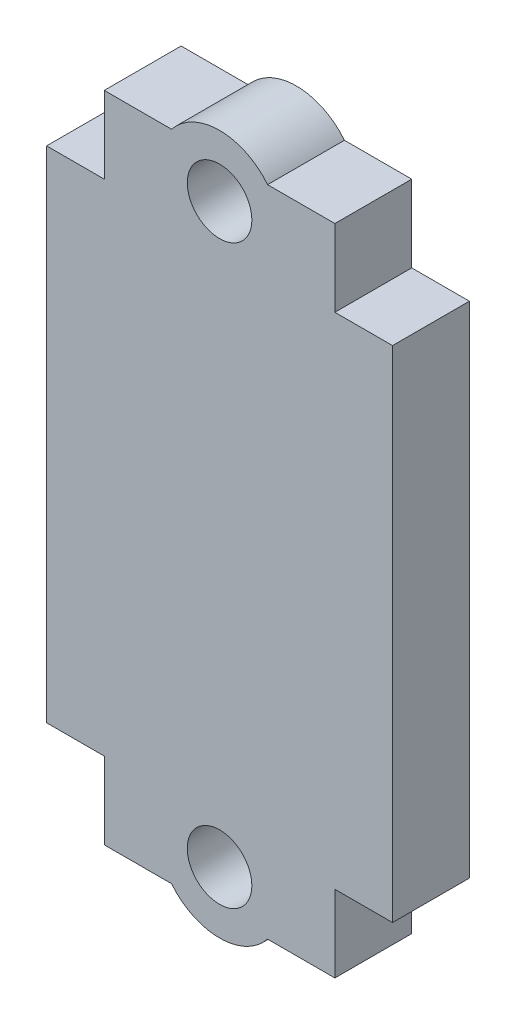
from build123d import *

# Parameters (mm, degrees)
SKETCH1_R           = 2.1
SKETCH1_W           = 22.5
SKETCH1_H           = 32.5
BOSS_EXTRUDE1_DEPTH = 5


with BuildPart() as part:
    # Sketch1 → Boss-Extrude1 (new body)
    # profile 1 of 5: a face of its own
    with BuildSketch(Plane.XY):
        Polygon((-18.75, 32.5), (-3.75, 32.5), (-3.75, 37.5), (-8.127501001, 37.5), (-14.372498999, 37.5), (-18.75, 37.5), align=None)
        with Locations((-11.25, 35)):
            Circle(SKETCH1_R, mode=Mode.SUBTRACT)
    # profile 2 of 5: a face of its own
    with BuildSketch(Plane.XY):
        with Locations((-11.25, 16.25)):
            Rectangle(SKETCH1_W, SKETCH1_H)
    # profile 3 of 5: a face of its own
    with BuildSketch(Plane.XY):
        Polygon((-3.75, -5), (-3.75, 0), (-18.75, 0), (-18.75, -5), (-14.372498999, -5), (-8.127501001, -5), align=None)
        with Locations((-11.25, -2.5)):
            Circle(SKETCH1_R, mode=Mode.SUBTRACT)
    # profile 4 of 5: a face of its own
    with BuildSketch(Plane.XY):
        with BuildLine():
            ThreePointArc((-14.372498999, -5), (-11.25, -6.5), (-8.127501001, -5))
            Line((-8.127501001, -5), (-14.372498999, -5))
        make_face()
    # profile 5 of 5: a face of its own
    with BuildSketch(Plane.XY):
        with BuildLine():
            ThreePointArc((-8.127501001, 37.5), (-11.25, 39), (-14.372498999, 37.5))
            Line((-14.372498999, 37.5), (-8.127501001, 37.5))
        make_face()
    extrude(amount=BOSS_EXTRUDE1_DEPTH)


solid = part.part
